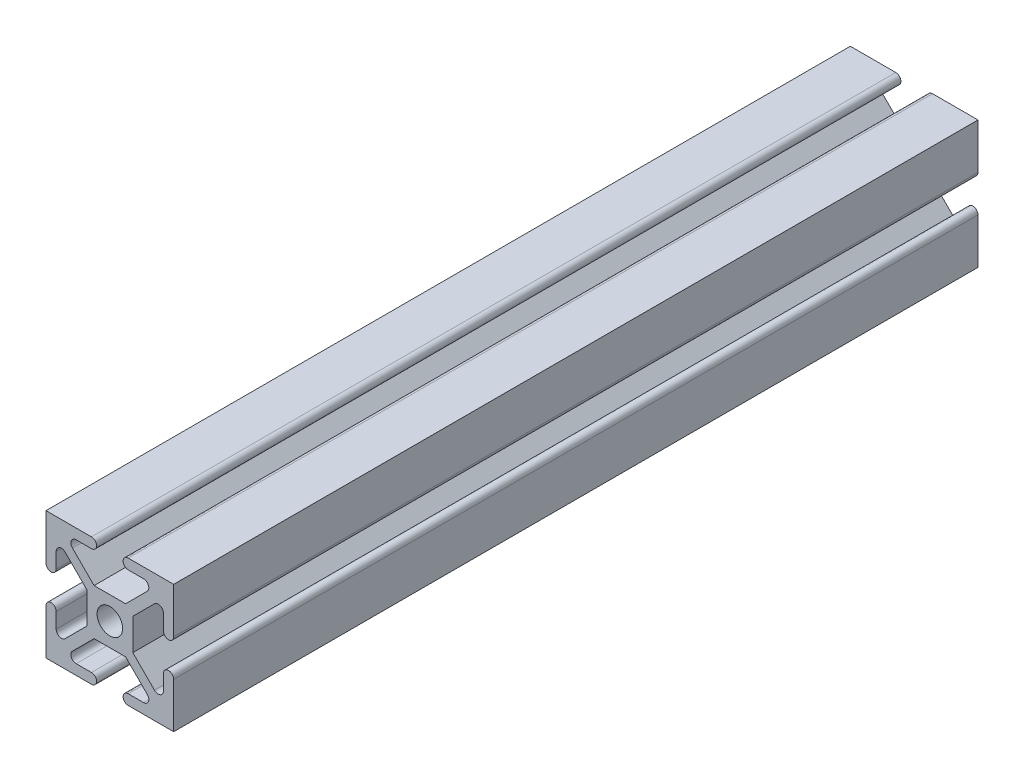
from build123d import *

# Parameters (mm, degrees)
SKETCH2_R           = 2.5
BOSS_EXTRUDE1_DEPTH = 157.5


with BuildPart() as part:
    # Sketch2 → Boss-Extrude1 (new body)
    with BuildSketch(Plane.XY):
        with BuildLine():
            ThreePointArc((16.100505063, 0), (15.100505063, 1), (16.100505063, 2))
            Line((16.100505063, 2), (19.100505063, 2))
            ThreePointArc((19.100505063, 2), (20.05158107, 2.635488671), (19.828427125, 3.757359313))
            Line((19.828427125, 3.757359313), (15.585786438, 8))
            Line((15.585786438, 8), (12.5, 8))
            Line((12.5, 8), (9.414213562, 8))
            Line((9.414213562, 8), (5.171572875, 3.757359313))
            ThreePointArc((5.171572875, 3.757359313), (4.94841893, 2.635488671), (5.899494937, 2))
            Line((5.899494937, 2), (8.899494937, 2))
            ThreePointArc((8.899494937, 2), (9.899494937, 1), (8.899494937, 0))
            Line((8.899494937, 0), (0, 0))
            Line((0, 0), (0, 8.899494937))
            ThreePointArc((0, 8.899494937), (1, 9.899494937), (2, 8.899494937))
            Line((2, 8.899494937), (2, 5.899494937))
            ThreePointArc((2, 5.899494937), (2.635488671, 4.94841893), (3.757359313, 5.171572875))
            Line((3.757359313, 5.171572875), (8, 9.414213562))
            Line((8, 9.414213562), (8, 12.5))
            Line((8, 12.5), (8, 15.585786438))
            Line((8, 15.585786438), (3.757359313, 19.828427125))
            ThreePointArc((3.757359313, 19.828427125), (2.635488671, 20.05158107), (2, 19.100505063))
            Line((2, 19.100505063), (2, 16.100505063))
            ThreePointArc((2, 16.100505063), (1, 15.100505063), (0, 16.100505063))
            Line((0, 16.100505063), (0, 25))
            Line((0, 25), (8.899494937, 25))
            ThreePointArc((8.899494937, 25), (9.899494937, 24), (8.899494937, 23))
            Line((8.899494937, 23), (5.899494937, 23))
            ThreePointArc((5.899494937, 23), (4.94841893, 22.364511329), (5.171572875, 21.242640687))
            Line((5.171572875, 21.242640687), (9.414213562, 17))
            Line((9.414213562, 17), (12.5, 17))
            Line((12.5, 17), (15.585786438, 17))
            Line((15.585786438, 17), (19.828427125, 21.242640687))
            ThreePointArc((19.828427125, 21.242640687), (20.05158107, 22.364511329), (19.100505063, 23))
            Line((19.100505063, 23), (16.100505063, 23))
            ThreePointArc((16.100505063, 23), (15.100505063, 24), (16.100505063, 25))
            Line((16.100505063, 25), (25, 25))
            Line((25, 25), (25, 16.100505063))
            ThreePointArc((25, 16.100505063), (24, 15.100505063), (23, 16.100505063))
            Line((23, 16.100505063), (23, 19.100505063))
            ThreePointArc((23, 19.100505063), (22.364511329, 20.05158107), (21.242640687, 19.828427125))
            Line((21.242640687, 19.828427125), (17, 15.585786438))
            Line((17, 15.585786438), (17, 12.5))
            Line((17, 12.5), (17, 9.414213562))
            Line((17, 9.414213562), (21.242640687, 5.171572875))
            ThreePointArc((21.242640687, 5.171572875), (22.364511329, 4.94841893), (23, 5.899494937))
            Line((23, 5.899494937), (23, 8.899494937))
            ThreePointArc((23, 8.899494937), (24, 9.899494937), (25, 8.899494937))
            Line((25, 8.899494937), (25, 0))
            Line((25, 0), (16.100505063, 0))
        make_face()
        with Locations((12.5, 12.5)):
            Circle(SKETCH2_R, mode=Mode.SUBTRACT)
    extrude(amount=BOSS_EXTRUDE1_DEPTH)


solid = part.part
